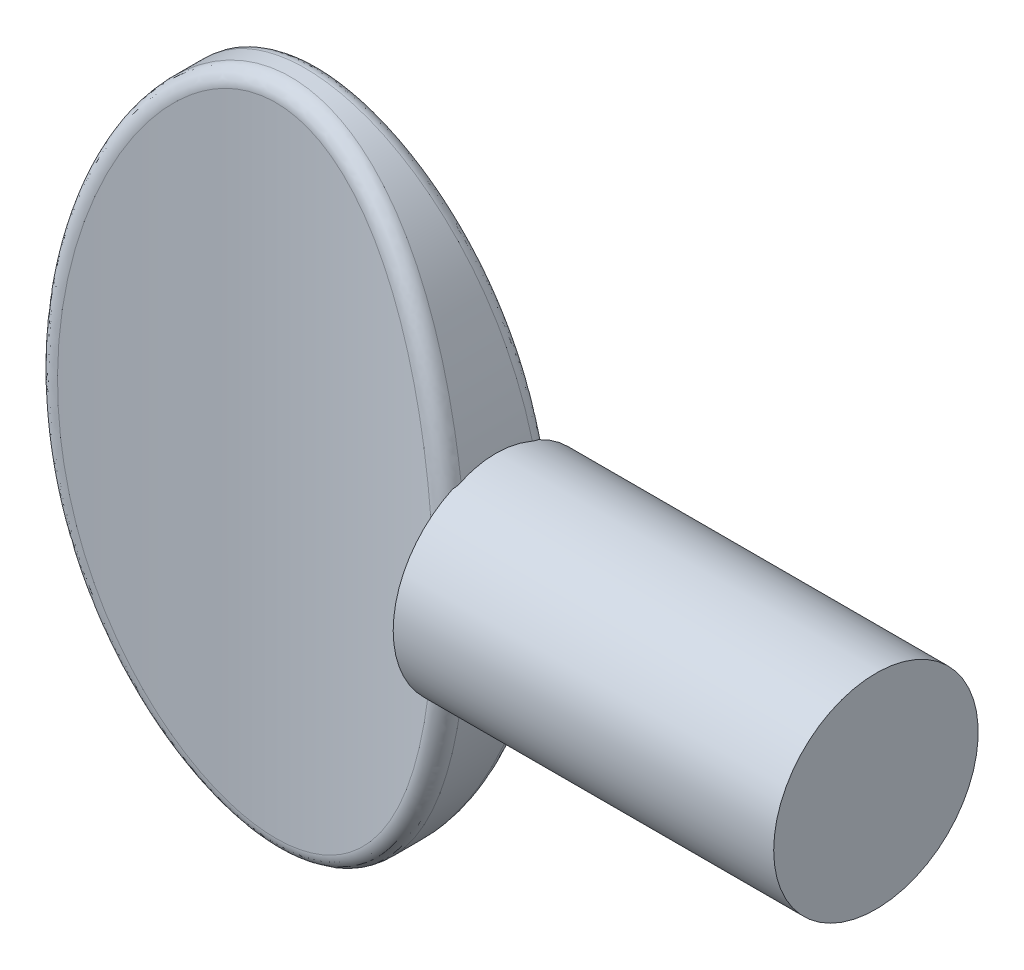
from build123d import *

# Parameters (mm, degrees)
SKETCH1_RX              = 5.715
SKETCH1_RY              = 3.556
EXTRUDE1_DEPTH          = 1.016
CUT_EXTRUDE1_DEPTH      = 7.8072473878947575
CUT_EXTRUDE1_DEPTH_BACK = 7.8072473878947575
SKETCH2_OUTSIDE_W       = 11.834000000000001
SKETCH2_OUTSIDE_H       = 6.754
FILLET3_R               = 0.254


with BuildPart() as part:
    # Sketch1 → Extrude1 (new, symmetric)
    with BuildSketch(Plane.XY):
        with Locations(Location((0, 0), (0, 0, -90))):
            Ellipse(SKETCH1_RX, SKETCH1_RY)
    extrude(amount=EXTRUDE1_DEPTH, both=True)

    # Sketch2 outside → Cut-Extrude1 (cut, two sides: drawn at the far end of the back side and taken through both)
    with BuildSketch(Plane(origin=(0, 0, 0), x_dir=(1, 0, 0), z_dir=(0, 1, 0)).offset(-CUT_EXTRUDE1_DEPTH_BACK)):
        Rectangle(SKETCH2_OUTSIDE_W, SKETCH2_OUTSIDE_H)
        with BuildLine():
            Line((-3.556, 1.016), (-3.556, -1.016))
            ThreePointArc((-3.556, -1.016), (6.3e-16, -0.3810000000000002), (3.556, -1.016))
            Line((3.556, -1.016), (3.556, 1.016))
            ThreePointArc((3.556, 1.016), (6.3e-16, 0.3810000000000002), (-3.556, 1.016))
        make_face(mode=Mode.SUBTRACT)
    extrude(amount=CUT_EXTRUDE1_DEPTH + CUT_EXTRUDE1_DEPTH_BACK, mode=Mode.SUBTRACT)

    # Fillet3
    fillet3_edges = [part.edges().sort_by_distance(p)[0] for p in [
        (-2.772297743363364, -3.579097133488567, 0.7620899166368158),
        (6.761380256e-08, 5.714999999994567, -0.38099999999467776),
    ]]
    fillet(fillet3_edges, radius=FILLET3_R)

    # Sketch3 → Revolve1 (revolve)
    with BuildSketch(Plane(origin=(0, 0, 0), x_dir=(1, 0, 0), z_dir=(0, 1, 0))):
        with BuildLine():
            Line((4.741333333333333, 1.7526), (9.906, 1.7526))
            Line((9.906, 1.7526), (9.906, 0))
            Line((9.906, 0), (2.577464628985661, 1e-17))
            Line((2.577464628985661, 1e-17), (2.577464628985661, 0.7095513315322604))
            ThreePointArc((2.577464628985661, 0.7095513315322604), (3.1592934071520324, 1.093146291526699), (3.3846611661960426, 1.7526000000000004))
            Line((3.3846611661960426, 1.7526000000000004), (4.741333333333333, 1.7526))
        make_face()
    revolve(axis=Axis((0, 0, 0), (1, 0, 0)))


solid = part.part
